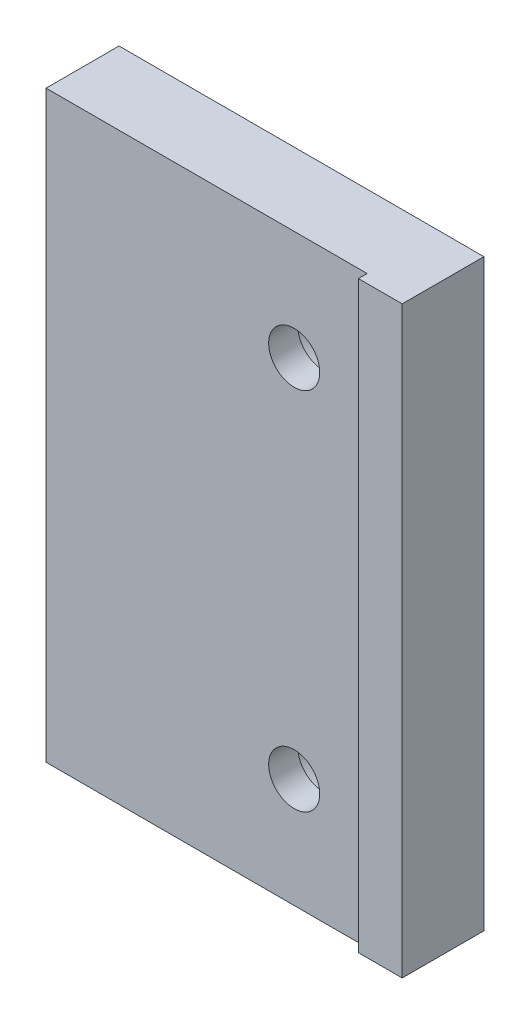
from build123d import *

# Parameters (mm, degrees)
SKETCH1_W           = 25
SKETCH1_H           = 40
SKETCH1_R           = 1.75
BOSS_EXTRUDE1_DEPTH = 5
SKETCH2_W           = 3
SKETCH2_H           = 40
BOSS_EXTRUDE2_DEPTH = 0.6
SKETCH3_R           = 3
CUT_EXTRUDE1_DEPTH  = 3


with BuildPart() as part:
    # Sketch1 → Boss-Extrude1 (new body)
    with BuildSketch(Plane.XY):
        with Locations((12.5, 20)):
            Rectangle(SKETCH1_W, SKETCH1_H)
        with Locations((17, 32.5)):
            Circle(SKETCH1_R, mode=Mode.SUBTRACT)
        with Locations((17, 7.5)):
            Circle(SKETCH1_R, mode=Mode.SUBTRACT)
    extrude(amount=BOSS_EXTRUDE1_DEPTH)

    # Sketch2 → Boss-Extrude2 (add)
    with BuildSketch(Plane.XY.offset(5)):
        with Locations((23.5, 20)):
            Rectangle(SKETCH2_W, SKETCH2_H)
    extrude(amount=BOSS_EXTRUDE2_DEPTH)

    # Sketch3 → Cut-Extrude1 (cut)
    with BuildSketch(Plane(origin=(0, 0, 0), x_dir=(-1, 0, 0), z_dir=(0, 0, -1))):
        with Locations((-17, 7.5)):
            Circle(SKETCH3_R)
        with Locations((-17, 32.5)):
            Circle(SKETCH3_R)
    extrude(amount=-CUT_EXTRUDE1_DEPTH, mode=Mode.SUBTRACT)


solid = part.part
